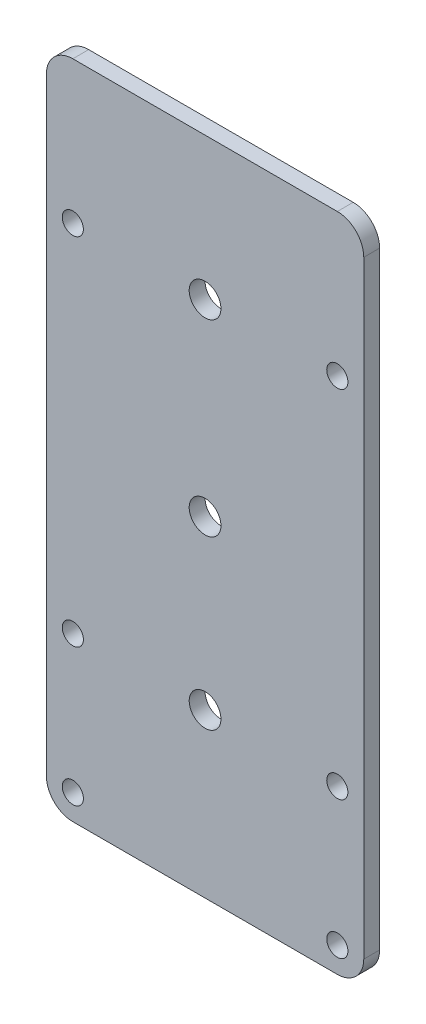
from build123d import *

# Parameters (mm, degrees)
SKETCH_1_W          = 60
SKETCH_1_H          = 124.895763786
SKETCH_1_R          = 2
SKETCH_1_R_2        = 3
EXTRUDE_1_DEPTH     = 3
FILLET_2_R          = 5
FILLET_3_R          = 5
FILLET_4_R          = 5
FILLET_5_R          = 5
SKETCH_2_R          = 3
CUT_EXTRUDE_1_DEPTH = 3


with BuildPart() as part:
    # Эскиз1 → Бобышка-Вытянуть1 (new body)
    with BuildSketch(Plane.XY):
        Rectangle(SKETCH_1_W, SKETCH_1_H)
        with Locations((-25, -57.647881893)):
            Circle(SKETCH_1_R, mode=Mode.SUBTRACT)
        with Locations((-25, -31.647881893)):
            Circle(SKETCH_1_R, mode=Mode.SUBTRACT)
        with Locations((-25, 35.532118107)):
            Circle(SKETCH_1_R, mode=Mode.SUBTRACT)
        with Locations((0, -31.647881893)):
            Circle(SKETCH_1_R_2, mode=Mode.SUBTRACT)
        with Locations((0, 35.532118107)):
            Circle(SKETCH_1_R_2, mode=Mode.SUBTRACT)
        with Locations(Location((25, 35.532118107, 0), (0, 0, 180))):
            Circle(SKETCH_1_R, mode=Mode.SUBTRACT)
        with Locations(Location((25, -31.647881893, 0), (0, 0, 180))):
            Circle(SKETCH_1_R, mode=Mode.SUBTRACT)
        with Locations(Location((25, -57.647881893, 0), (0, 0, 180))):
            Circle(SKETCH_1_R, mode=Mode.SUBTRACT)
    extrude(amount=EXTRUDE_1_DEPTH)

    # Скругление2
    fillet_2_edges = [part.edges().sort_by_distance(p)[0] for p in [
        (-30, 62.447881893, 1.5),
    ]]
    fillet(fillet_2_edges, radius=FILLET_2_R)

    # Скругление3
    fillet_3_edges = [part.edges().sort_by_distance(p)[0] for p in [
        (30, 62.447881893, 1.5),
    ]]
    fillet(fillet_3_edges, radius=FILLET_3_R)

    # Скругление4
    fillet_4_edges = [part.edges().sort_by_distance(p)[0] for p in [
        (30, -62.447881893, 1.5),
    ]]
    fillet(fillet_4_edges, radius=FILLET_4_R)

    # Скругление5
    fillet_5_edges = [part.edges().sort_by_distance(p)[0] for p in [
        (-30, -62.447881893, 1.5),
    ]]
    fillet(fillet_5_edges, radius=FILLET_5_R)

    # Эскиз2 → Вырез-Вытянуть1 (cut)
    with BuildSketch(Plane.XY.offset(3)):
        Circle(SKETCH_2_R)
    extrude(amount=-CUT_EXTRUDE_1_DEPTH, mode=Mode.SUBTRACT)


solid = part.part
